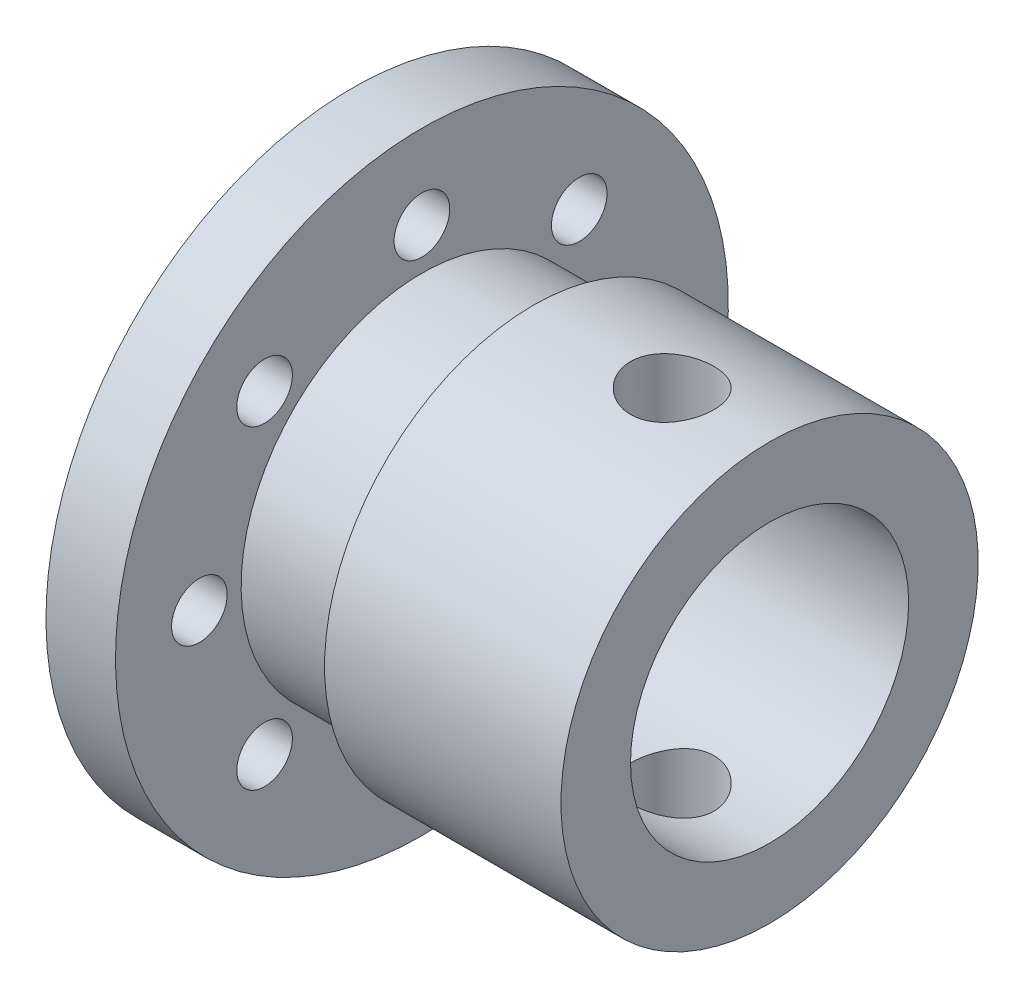
from build123d import *

# Parameters (mm, degrees)
CUT_EXTRUDE1_DEPTH      = 561.867355885
CUT_EXTRUDE1_DEPTH_BACK = 561.867355885
SKETCH3_R               = 1.5
SKETCH13_R              = 1
CUT_EXTRUDE2_DEPTH      = 20.974512648


with BuildPart() as part:
    # Sketch2 → Revolve1 (revolve)
    with BuildSketch(Plane.XY, mode=Mode.PRIVATE) as revolve1_sk:
        Polygon((560.650925037, 5), (560.650925037, 7.5), (552.150925037, 7.5), (552.150925037, 6.5), (548.150925037, 6.5), (548.150925037, 7.5), (548.150925037, 11.016604582), (545.650925037, 11.016604582), (545.650925037, 5), align=None)
    revolve(revolve1_sk.sketch.rotate(Axis((542.916757592, 0, 0), (1, 0, 0)), 180), axis=Axis((542.916757592, 0, 0), (1, 0, 0)))

    # Sketch3 → Cut-Extrude1 (cut, two sides: drawn at the far end of the back side and taken through both)
    with BuildSketch(Plane(origin=(0, 0, 0), x_dir=(1, 0, 0), z_dir=(0, 1, 0)).offset(-CUT_EXTRUDE1_DEPTH_BACK)):
        with Locations(Location((557.150925037, 0, 0), (0, 0, 270))):
            Circle(SKETCH3_R)
    extrude(amount=CUT_EXTRUDE1_DEPTH + CUT_EXTRUDE1_DEPTH_BACK, mode=Mode.SUBTRACT)

    # Sketch13 → Cut-Extrude2 (cut, through all)
    with BuildSketch(Plane(origin=(548.150925037, 0, 0), x_dir=(0, 0, -1), z_dir=(1, 0, 0))):
        with Locations(Location((0, 8, 0), (0, 0, 90))):
            Circle(SKETCH13_R)
        with Locations(Location((5.656854249, 5.656854249, 0), (0, 0, 90))):
            Circle(SKETCH13_R)
        with Locations(Location((8, 0, 0), (0, 0, 90))):
            Circle(SKETCH13_R)
        with Locations(Location((5.656854249, -5.656854249, 0), (0, 0, 90))):
            Circle(SKETCH13_R)
        with Locations(Location((0, -8, 0), (0, 0, 90))):
            Circle(SKETCH13_R)
        with Locations(Location((-5.656854249, -5.656854249, 0), (0, 0, 90))):
            Circle(SKETCH13_R)
        with Locations(Location((-8, 0, 0), (0, 0, 90))):
            Circle(SKETCH13_R)
        with Locations(Location((-5.656854249, 5.656854249, 0), (0, 0, 90))):
            Circle(SKETCH13_R)
    extrude(amount=-CUT_EXTRUDE2_DEPTH, mode=Mode.SUBTRACT)


solid = part.part
